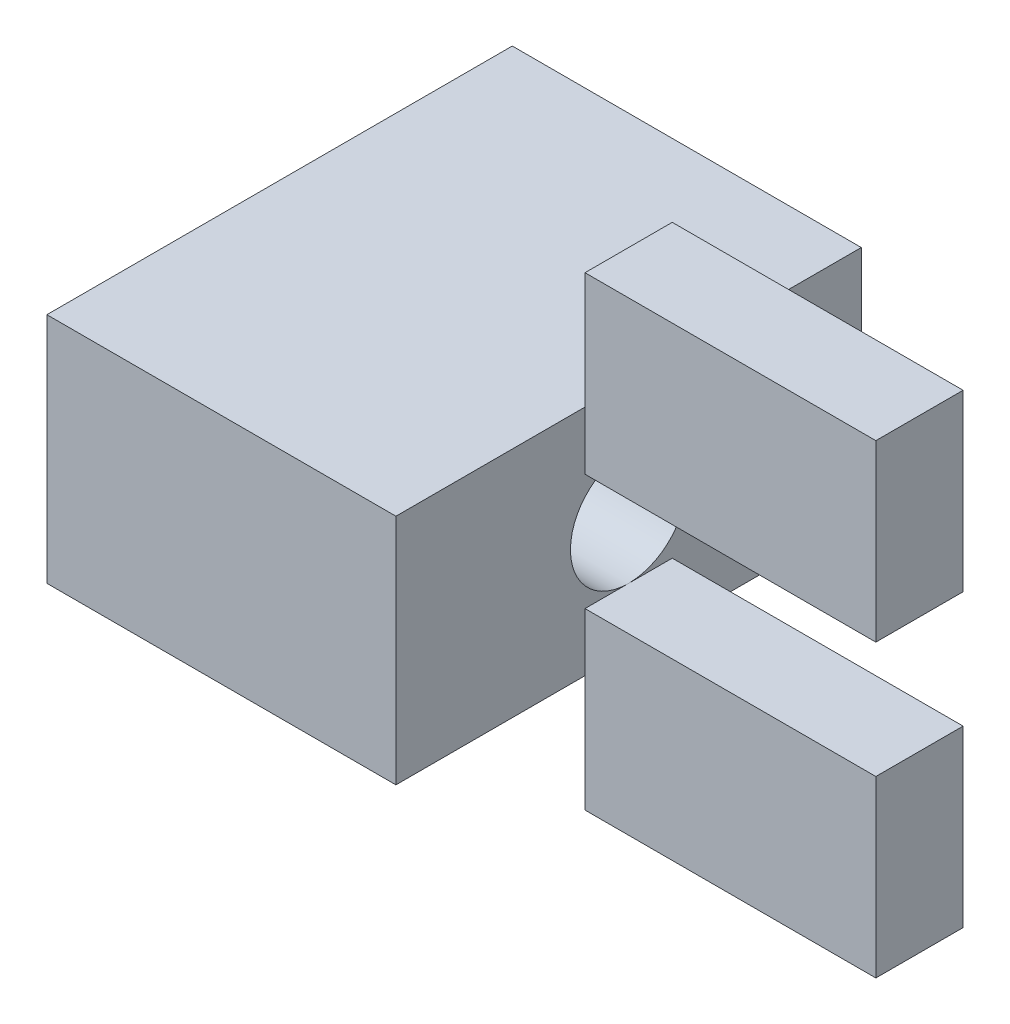
from build123d import *

# Parameters (mm, degrees)
SKETCH1_W           = 80
SKETCH1_H           = 40
BOSS_EXTRUDE1_DEPTH = 60
SKETCH2_R           = 10
CUT_EXTRUDE1_DEPTH  = 60
SKETCH3_W           = 15
SKETCH3_H           = 30
BOSS_EXTRUDE2_DEPTH = 50


with BuildPart() as part:
    # Sketch1 → Boss-Extrude1 (new body)
    with BuildSketch(Plane(origin=(0, 0, 0), x_dir=(0, 0, -1), z_dir=(1, 0, 0))):
        Rectangle(SKETCH1_W, SKETCH1_H)
    extrude(amount=BOSS_EXTRUDE1_DEPTH)

    # Sketch2 → Cut-Extrude1 (cut)
    with BuildSketch(Plane(origin=(0, 0, 0), x_dir=(0, 0, -1), z_dir=(1, 0, 0))):
        Circle(SKETCH2_R)
    extrude(amount=CUT_EXTRUDE1_DEPTH, mode=Mode.SUBTRACT)

    # Sketch3 → Boss-Extrude2 (add)
    with BuildSketch(Plane(origin=(60, 0, 0), x_dir=(0, 0, -1), z_dir=(1, 0, 0))):
        with Locations((0, 25)):
            Rectangle(SKETCH3_W, SKETCH3_H)
        with Locations((0, -25)):
            Rectangle(SKETCH3_W, SKETCH3_H)
    extrude(amount=BOSS_EXTRUDE2_DEPTH)


solid = part.part
